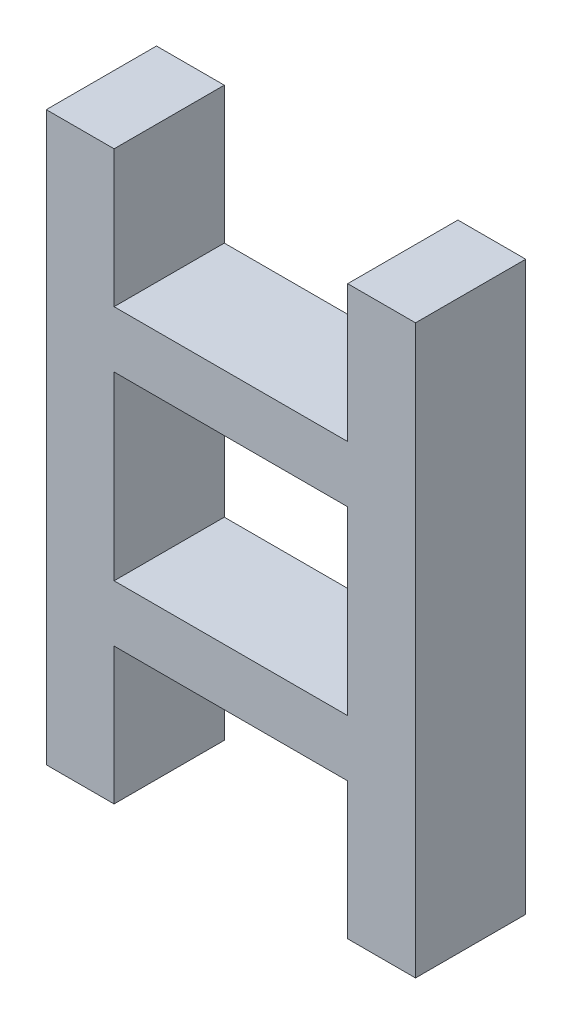
from build123d import *

# Parameters (mm, degrees)
SKETCH1_W           = 12.4
SKETCH1_H           = 9.6
BOSS_EXTRUDE1_DEPTH = 5.85


with BuildPart() as part:
    # Sketch1 → Boss-Extrude1 (new body)
    with BuildSketch(Plane.XY):
        Polygon((1247.209623553, 948.827195661), (1247.209623553, 941.568029888), (1243.609623553, 941.568029888), (1243.609623553, 971.686361434), (1247.209623553, 971.686361434), (1247.209623553, 964.427195661), (1259.609623553, 964.427195661), (1259.609623553, 971.686361434), (1263.209623553, 971.686361434), (1263.209623553, 941.568029888), (1259.609623553, 941.568029888), (1259.609623553, 948.827195661), align=None)
        with Locations((1253.409623553, 956.627195661)):
            Rectangle(SKETCH1_W, SKETCH1_H, mode=Mode.SUBTRACT)
    extrude(amount=BOSS_EXTRUDE1_DEPTH)


solid = part.part
